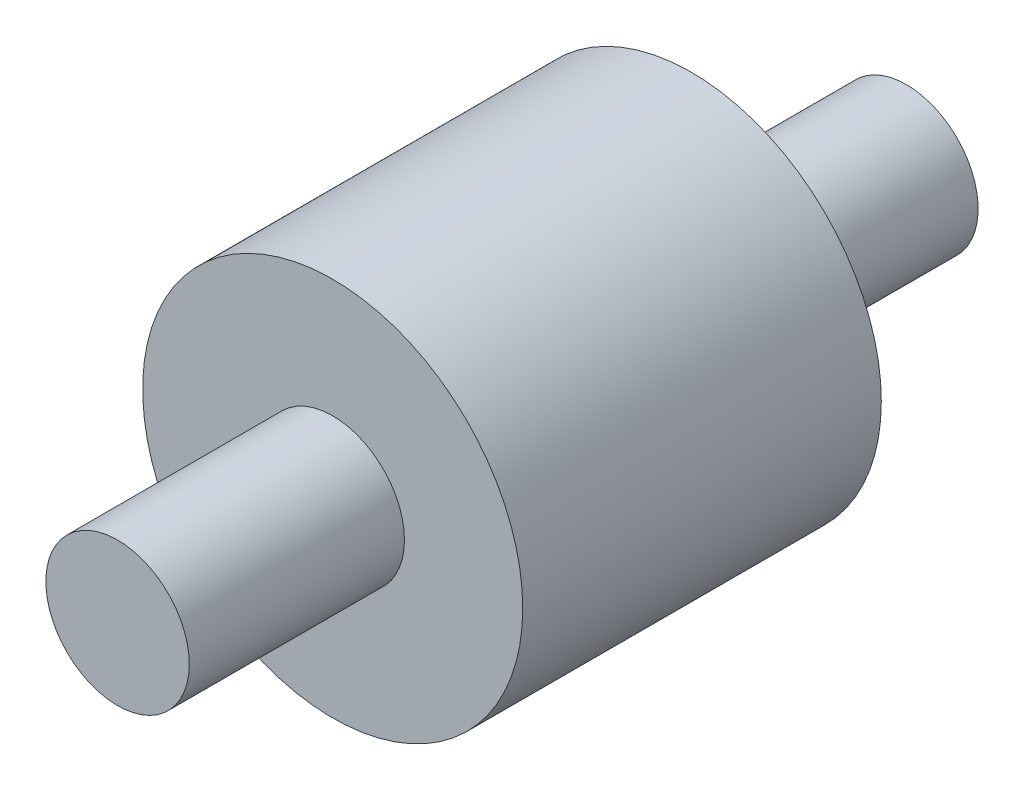
from build123d import *

# Parameters (mm, degrees)
SKETCH1_R           = 26.5
BOSS_EXTRUDE1_DEPTH = 25
SKETCH2_R           = 10
BOSS_EXTRUDE2_DEPTH = 30
BOSS_EXTRUDE3_START = 30
SKETCH3_R           = 10
BOSS_EXTRUDE3_DEPTH = 30


with BuildPart() as part:
    # Sketch1 → Boss-Extrude1 (new, symmetric)
    with BuildSketch(Plane.XY):
        Circle(SKETCH1_R)
    extrude(amount=BOSS_EXTRUDE1_DEPTH, both=True)

    # Sketch2 → Boss-Extrude2 (add)
    with BuildSketch(Plane(origin=(0, 0, -25), x_dir=(-1, 0, 0), z_dir=(0, 0, -1))):
        Circle(SKETCH2_R)
    extrude(amount=BOSS_EXTRUDE2_DEPTH)

    # Sketch3 → Boss-Extrude3 (add)
    with BuildSketch(Plane.XY.offset(25).offset(BOSS_EXTRUDE3_START)):
        with Locations(Location((0, 0, 0), (0, 0, 180))):
            Circle(SKETCH3_R)
    extrude(amount=-BOSS_EXTRUDE3_DEPTH)


solid = part.part
